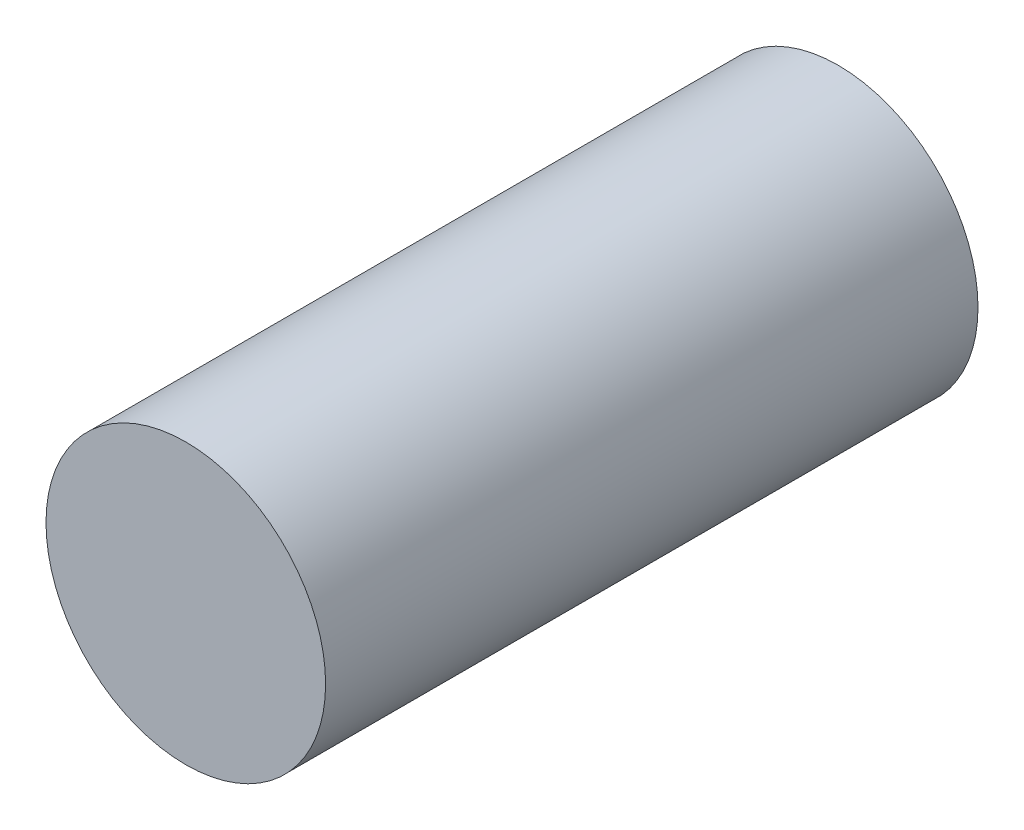
from build123d import *

# Parameters (mm, degrees)
SKETCH1_R                 = 6
EX_PLANET_PIN_12X24_DEPTH = 14


with BuildPart() as part:
    # Sketch1 → EX_Planet_Pin_Ø12x24 (new, symmetric)
    with BuildSketch(Plane.XY):
        with Locations(Location((0, 0, 0), (0, 0, 180))):
            Circle(SKETCH1_R)
    extrude(amount=EX_PLANET_PIN_12X24_DEPTH, both=True)


solid = part.part
